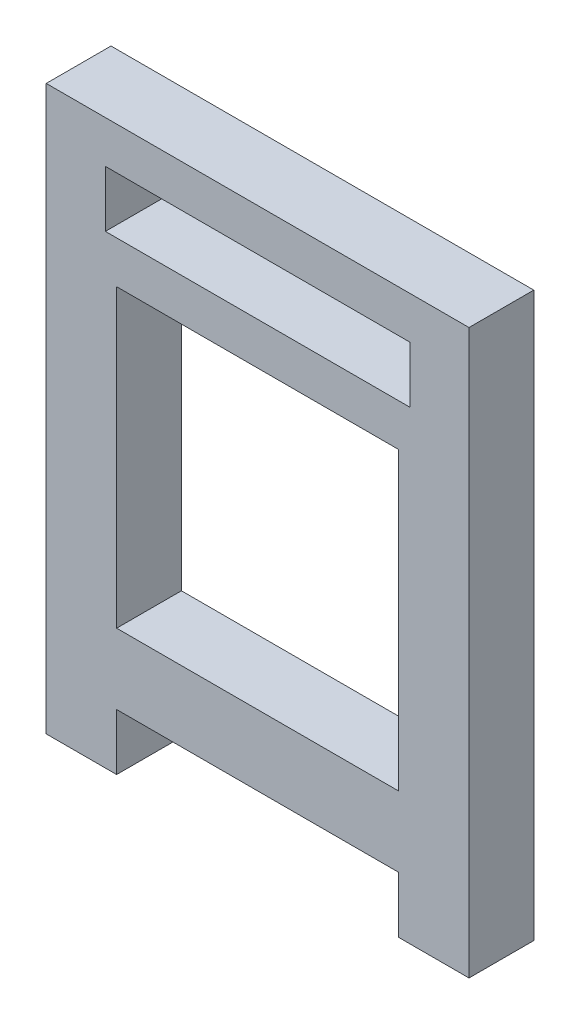
from build123d import *

# Parameters (mm, degrees)
SKETCH1_W           = 10.01
SKETCH1_H           = 10.5
SKETCH1_W_2         = 10.81
SKETCH1_H_2         = 2
BOSS_EXTRUDE1_DEPTH = 2.3


with BuildPart() as part:
    # Sketch1 → Boss-Extrude1 (new body)
    with BuildSketch(Plane.XY):
        Polygon((0, 0), (0, -2), (2.5, -2), (2.5, 0), (12.51, 0), (12.51, -2), (15.01, -2), (15.01, 0), (15.01, 18), (0, 18), align=None)
        with Locations((7.505, 7.75)):
            Rectangle(SKETCH1_W, SKETCH1_H, mode=Mode.SUBTRACT)
        with Locations((7.505, 15.5)):
            Rectangle(SKETCH1_W_2, SKETCH1_H_2, mode=Mode.SUBTRACT)
    extrude(amount=BOSS_EXTRUDE1_DEPTH)


solid = part.part
